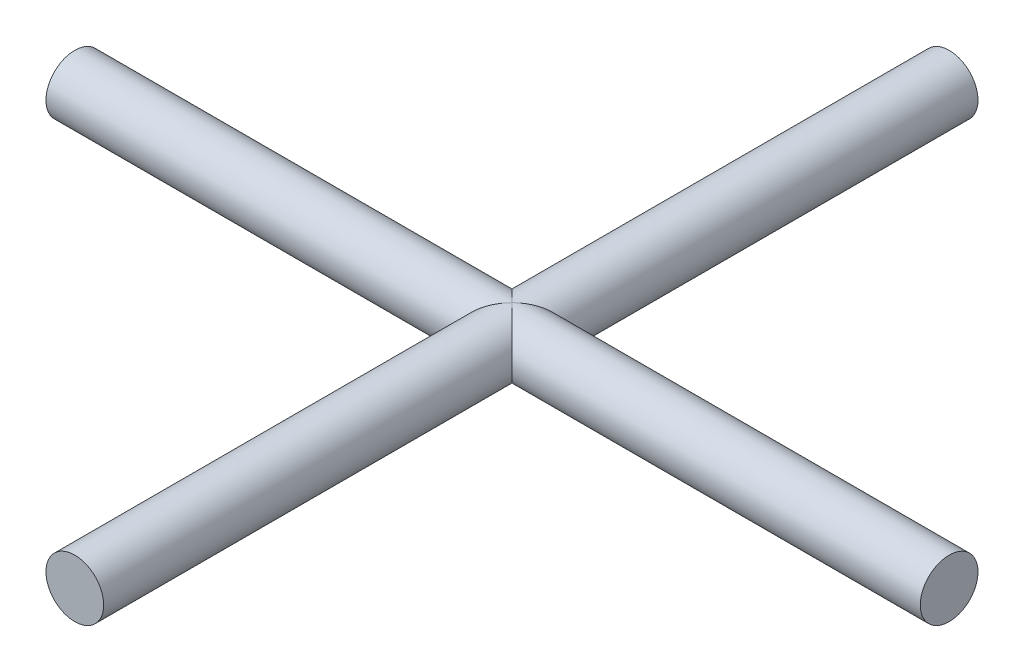
from build123d import *

# Parameters (mm, degrees)
SKETCH2_R           = 2.475
BOSS_EXTRUDE1_DEPTH = 37.5
CIRPATTERN1_COUNT   = 2
CIRPATTERN1_ANGLE   = 90


with BuildPart() as part:
    # Sketch2 → Boss-Extrude1 (new, symmetric)
    with BuildSketch(Plane.XY):
        Circle(SKETCH2_R)
    boss_extrude1 = extrude(amount=BOSS_EXTRUDE1_DEPTH, both=True)

    # CirPattern1: Boss-Extrude1 ×2 about axis
    cirpattern1_axis = Axis((0, -2.7225, 0), (0, 1, 0))
    for i in range(1, CIRPATTERN1_COUNT):
        add(boss_extrude1.rotate(cirpattern1_axis, i * CIRPATTERN1_ANGLE / (CIRPATTERN1_COUNT - 1)))


solid = part.part
